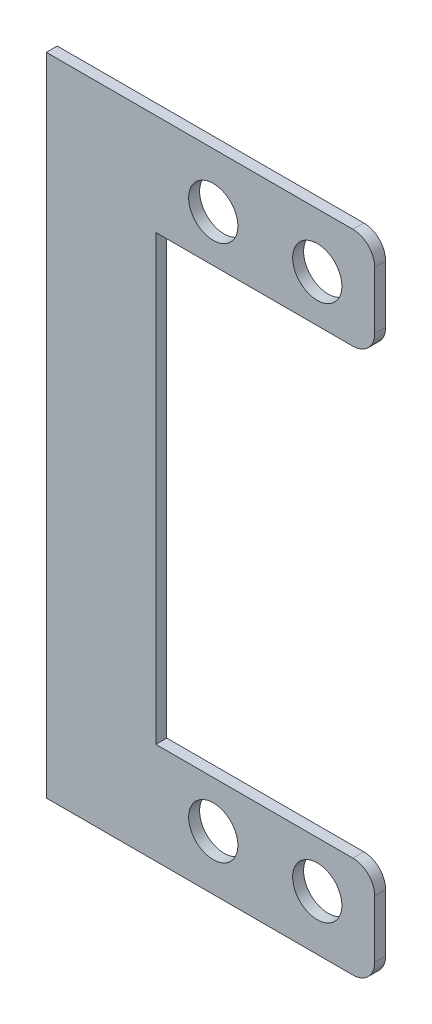
from build123d import *

# Parameters (mm, degrees)
SKETCH1_R           = 2.25
BOSS_EXTRUDE1_DEPTH = 1


with BuildPart() as part:
    # Sketch1 → Boss-Extrude1 (new body)
    with BuildSketch(Plane.XY):
        with BuildLine():
            Line((20, 42.5), (20, 47.75))
            ThreePointArc((20, 47.75), (19.414213562, 49.164213562), (18, 49.75))
            Line((18, 49.75), (-10, 49.75))
            Line((-10, 49.75), (-10, -9.25))
            Line((-10, -9.25), (18, -9.25))
            ThreePointArc((18, -9.25), (19.414213562, -8.664213562), (20, -7.25))
            Line((20, -7.25), (20, -2))
            ThreePointArc((20, -2), (19.414213562, -0.585786438), (18, 0))
            Line((18, 0), (0, 0))
            Line((0, 0), (0, 40.5))
            Line((0, 40.5), (18, 40.5))
            ThreePointArc((18, 40.5), (19.414213562, 41.085786438), (20, 42.5))
        make_face()
        with Locations((5.25, 44.75)):
            Circle(SKETCH1_R, mode=Mode.SUBTRACT)
        with Locations((14.75, 44.75)):
            Circle(SKETCH1_R, mode=Mode.SUBTRACT)
        with Locations((14.75, -4.25)):
            Circle(SKETCH1_R, mode=Mode.SUBTRACT)
        with Locations((5.25, -4.25)):
            Circle(SKETCH1_R, mode=Mode.SUBTRACT)
    extrude(amount=BOSS_EXTRUDE1_DEPTH)


solid = part.part
